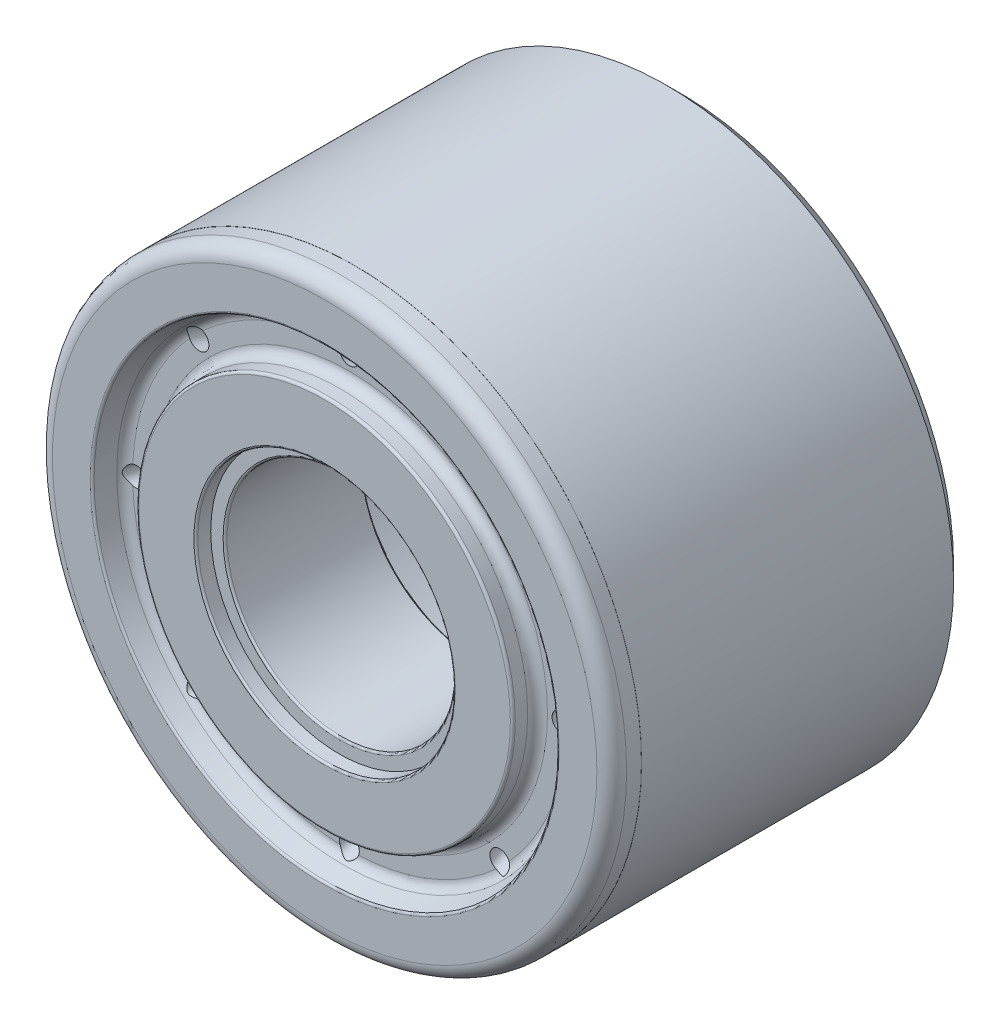
from build123d import *
from build123d.topology import SkipClean

# Parameters (mm, degrees)
CIRPATTERN1_COUNT = 8
CIRPATTERN2_COUNT = 4
CIRPATTERN4_COUNT = 4
CIRPATTERN5_COUNT = 4


with BuildPart() as part:
    # Sketch1 → Revolve1 (revolve)
    with BuildSketch(Plane(origin=(0, 0, 0), x_dir=(0, 0, -1), z_dir=(1, 0, 0)), mode=Mode.PRIVATE) as revolve1_sk:
        with BuildLine():
            Line((0, 26.4), (0, 37.5))
            ThreePointArc((0, 37.5), (0.146446609, 37.853553391), (0.5, 38))
            Line((0.5, 38), (3, 38))
            ThreePointArc((3, 38), (4.414213562, 38.585786438), (5, 40))
            Line((5, 40), (5, 43.779733752))
            ThreePointArc((5, 43.779733752), (4.638304089, 44.926886625), (3.684040287, 45.659118994))
            Line((3.684040287, 45.659118994), (0.328989928, 46.880257459))
            ThreePointArc((0.328989928, 46.880257459), (0.090423978, 47.063315551), (0, 47.350103769))
            Line((0, 47.350103769), (0, 54.975))
            ThreePointArc((0, 54.975), (0.878679656, 57.096320344), (3, 57.975))
            Line((3, 57.975), (6, 57.975))
            Line((6, 57.975), (6, 58))
            Line((6, 58), (69, 58))
            Line((69, 58), (72, 55))
            Line((72, 55), (72, 48))
            ThreePointArc((72, 48), (71.853553391, 47.646446609), (71.5, 47.5))
            Line((71.5, 47.5), (63.5, 47.5))
            ThreePointArc((63.5, 47.5), (63, 48), (62.5, 47.5))
            Line((62.5, 47.5), (45.5, 47.5))
            ThreePointArc((45.5, 47.5), (45, 48), (44.5, 47.5))
            Line((44.5, 47.5), (36, 47.5))
            Line((36, 47.5), (35, 48.5))
            Line((35, 48.5), (33, 48.5))
            ThreePointArc((33, 48.5), (31.585786438, 47.914213562), (31, 46.5))
            Line((31, 46.5), (31, 44.3))
            ThreePointArc((31, 44.3), (31.234314575, 43.734314575), (31.8, 43.5))
            Line((31.8, 43.5), (32, 43.5))
            ThreePointArc((32, 43.5), (32.353553391, 43.353553391), (32.5, 43))
            Line((32.5, 43), (32.5, 25.75))
            ThreePointArc((32.5, 25.75), (32.353553391, 25.396446609), (32, 25.25))
            Line((32, 25.25), (31, 25.25))
            Line((31, 25.25), (31, 23.602887421))
            Line((31, 23.602887421), (30.5, 23.102887421))
            Line((30.5, 23.102887421), (3.4, 23.102887421))
            ThreePointArc((3.4, 23.102887421), (3.117157288, 23.220044708), (3, 23.502887421))
            Line((3, 23.502887421), (3, 26))
            Line((3, 26), (0.4, 26))
            ThreePointArc((0.4, 26), (0.117157288, 26.117157288), (0, 26.4))
        make_face()
    revolve(revolve1_sk.sketch.rotate(Axis((0, 0, 0), (0, 0, -1)), 90), axis=Axis((0, 0, 0), (0, 0, -1)))

    # Sketch2 → Cut-Revolve1 (revolve, cut)
    with BuildSketch(Plane(origin=(0, 0, 0), x_dir=(0, 0, -1), z_dir=(1, 0, 0)), mode=Mode.PRIVATE) as cut_revolve1_sk:
        Polygon((5, 43), (3.684040287, 45.423162703), (34.879378881, 37.064396919), (32.5, 35.631397208), align=None)
    cut_revolve1 = revolve(cut_revolve1_sk.sketch.rotate(Axis((0, 43, -5), (0, -0.25881904510252135, -0.9659258262890681)), 69.063852371), axis=Axis((0, 43, -5), (0, -0.25881904510252135, -0.9659258262890681)), mode=Mode.SUBTRACT)

    # CirPattern1: Cut-Revolve1 ×8 about axis
    cirpattern1_axis = Axis((0, 0, 0), (0, 0, 1))
    for i in range(1, CIRPATTERN1_COUNT):
        add(cut_revolve1.rotate(cirpattern1_axis, i * 360 / CIRPATTERN1_COUNT), mode=Mode.SUBTRACT)

    # Sketch4 → Cut-Revolve2 (revolve, cut)
    with BuildSketch(Plane(origin=(0, 0, 0), x_dir=(0, 0, -1), z_dir=(1, 0, 0))):
        with BuildLine():
            Line((35, 44), (31, 44))
            Line((31, 44), (31, 31))
            ThreePointArc((31, 31), (32.171572875, 28.171572875), (35, 27))
            Line((35, 27), (35, 44))
        make_face()
    cut_revolve2 = revolve(axis=Axis((0, 27, -35), (0, 1, 0)), mode=Mode.SUBTRACT)

    # CirPattern2: Cut-Revolve2 ×4 about axis
    cirpattern2_axis = Axis((0, 0, 0), (0, 0, 1))
    for i in range(1, CIRPATTERN2_COUNT):
        add(cut_revolve2.rotate(cirpattern2_axis, i * 360 / CIRPATTERN2_COUNT), mode=Mode.SUBTRACT)

    # Sketch7 → Cut-Revolve4 (revolve, cut)
    with BuildSketch(Plane(origin=(0, 0, 0), x_dir=(0, 0, 1), z_dir=(-0.7071067811865512, 0.7071067811865438, 0))):
        with BuildLine():
            Line((-35, 41.5), (-35, 24.5))
            Line((-35, 24.5), (-31, 24.5))
            Line((-31, 24.5), (-31, 37.5))
            ThreePointArc((-31, 37.5), (-32.171572875, 40.328427125), (-35, 41.5))
        make_face()
    cut_revolve4 = revolve(axis=Axis((29.344931419, 29.344931419, -35), (-0.7071067811865438, -0.7071067811865513, 0)), mode=Mode.SUBTRACT)

    # CirPattern4: Cut-Revolve4 ×4 about axis
    cirpattern4_axis = Axis((0, 0, 0), (0, 0, 1))
    for i in range(1, CIRPATTERN4_COUNT):
        add(cut_revolve4.rotate(cirpattern4_axis, i * 360 / CIRPATTERN4_COUNT), mode=Mode.SUBTRACT)

    # Sketch9 → Cut-Revolve5 (revolve, cut)
    with SkipClean():  # the faces are left unmerged after this step: merging them gives an invalid solid
        with BuildSketch(Plane(origin=(0, 0, 0), x_dir=(0, 0, 1), z_dir=(0.38268343236508734, 0.9238795325112877, 0))):
            with BuildLine():
                Line((-34, 40), (-34, 36))
                ThreePointArc((-34, 36), (-32, 38), (-34, 40))
            make_face()
        cut_revolve5 = revolve(axis=Axis((36.9551813, -15.307337295, -34), (-0.9238795325112876, 0.3826834323650878, 0)), mode=Mode.SUBTRACT)

    # CirPattern5: Cut-Revolve5 ×4 about axis
    with SkipClean():  # the faces are left unmerged after this step: merging them gives an invalid solid
        cirpattern5_axis = Axis((0, 0, 0), (0, 0, 1))
        for i in range(1, CIRPATTERN5_COUNT):
            add(cut_revolve5.rotate(cirpattern5_axis, i * 360 / CIRPATTERN5_COUNT), mode=Mode.SUBTRACT)


solid = part.part
